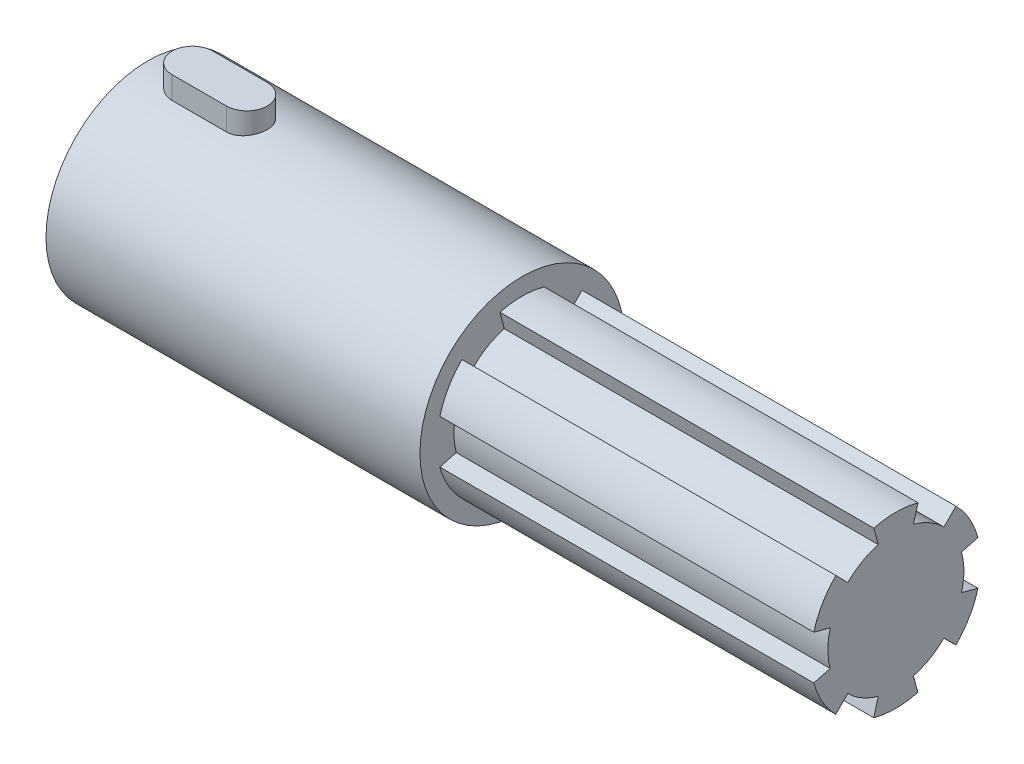
from build123d import *

# Parameters (mm, degrees)
SKETCH_1_R          = 15
EXTRUDE_1_DEPTH     = 55
SKETCH_2_R          = 10
EXTRUDE_2_DEPTH     = 55
SKETCH_3_R          = 5
CUT_EXTRUDE_1_DEPTH = 25
EXTRUDE_START       = 10
EXTRUDE_3_DEPTH     = 8


with BuildPart() as part:
    # 草图1 → 凸台-拉伸1 (new body)
    with BuildSketch(Plane(origin=(0, 0, 0), x_dir=(0, 0, -1), z_dir=(1, 0, 0))):
        Circle(SKETCH_1_R)
    extrude(amount=EXTRUDE_1_DEPTH)

    # 草图2 → 凸台-拉伸2 (add)
    with BuildSketch(Plane(origin=(55, 0, 0), x_dir=(0, 0, -1), z_dir=(1, 0, 0))):
        with BuildLine():
            ThreePointArc((-9.659258263, 2.588190451), (-8.660254038, 5), (-7.071067812, 7.071067812))
            Line((-7.071067812, 7.071067812), (-8.825622579, 8.852027231))
            ThreePointArc((-8.825622579, 8.852027231), (-10.8206468, 6.258083), (-12.074072829, 3.235238064))
            Line((-12.074072829, 3.235238064), (-9.659258263, 2.588190451))
        make_face()
        Circle(SKETCH_2_R)
        with BuildLine():
            ThreePointArc((3.253269167, 12.069226973), (0.009335457, 12.499996514), (-3.235238064, 12.074072829))
            Line((-3.235238064, 12.074072829), (-2.588190451, 9.659258263))
            ThreePointArc((-2.588190451, 9.659258263), (0, 10), (2.588190451, 9.659258263))
            Line((2.588190451, 9.659258263), (3.253269167, 12.069226973))
        make_face()
        with BuildLine():
            Line((8.838834765, 8.838834765), (7.071067812, 7.071067812))
            ThreePointArc((7.071067812, 7.071067812), (8.660254038, 5), (9.659258263, 2.588190451))
            Line((9.659258263, 2.588190451), (12.078891746, 3.217199742))
            ThreePointArc((12.078891746, 3.217199742), (10.829982257, 6.241913514), (8.838834765, 8.838834765))
        make_face()
        with BuildLine():
            Line((12.074072829, -3.235238064), (9.659258263, -2.588190451))
            ThreePointArc((9.659258263, -2.588190451), (8.660254038, -5), (7.071067812, -7.071067812))
            Line((7.071067812, -7.071067812), (8.825622579, -8.852027231))
            ThreePointArc((8.825622579, -8.852027231), (10.8206468, -6.258083), (12.074072829, -3.235238064))
        make_face()
        with BuildLine():
            ThreePointArc((2.588190451, -9.659258263), (0, -10), (-2.588190451, -9.659258263))
            Line((-2.588190451, -9.659258263), (-3.253269167, -12.069226973))
            ThreePointArc((-3.253269167, -12.069226973), (-0.009335457, -12.499996514), (3.235238064, -12.074072829))
            Line((3.235238064, -12.074072829), (2.588190451, -9.659258263))
        make_face()
        with BuildLine():
            ThreePointArc((-7.071067812, -7.071067812), (-8.660254038, -5), (-9.659258263, -2.588190451))
            Line((-9.659258263, -2.588190451), (-12.078891746, -3.217199742))
            ThreePointArc((-12.078891746, -3.217199742), (-10.829982257, -6.241913514), (-8.838834765, -8.838834765))
            Line((-8.838834765, -8.838834765), (-7.071067812, -7.071067812))
        make_face()
    extrude(amount=EXTRUDE_2_DEPTH)

    # 草图3 → 切除-拉伸1 (cut)
    with BuildSketch(Plane.ZY):
        Circle(SKETCH_3_R)
    extrude(amount=-CUT_EXTRUDE_1_DEPTH, mode=Mode.SUBTRACT)

    # 草图4 → 凸台-拉伸3 (add)
    with BuildSketch(Plane(origin=(0, 0, 0), x_dir=(1, 0, 0), z_dir=(0, 1, 0)).offset(EXTRUDE_START)):
        with BuildLine():
            Line((6.545306006, 3), (14.545306006, 3))
            ThreePointArc((14.545306006, 3), (17.545306006, 0), (14.545306006, -3))
            Line((14.545306006, -3), (6.545306006, -3))
            ThreePointArc((6.545306006, -3), (3.545306006, 0), (6.545306006, 3))
        make_face()
    extrude(amount=EXTRUDE_3_DEPTH)


solid = part.part
